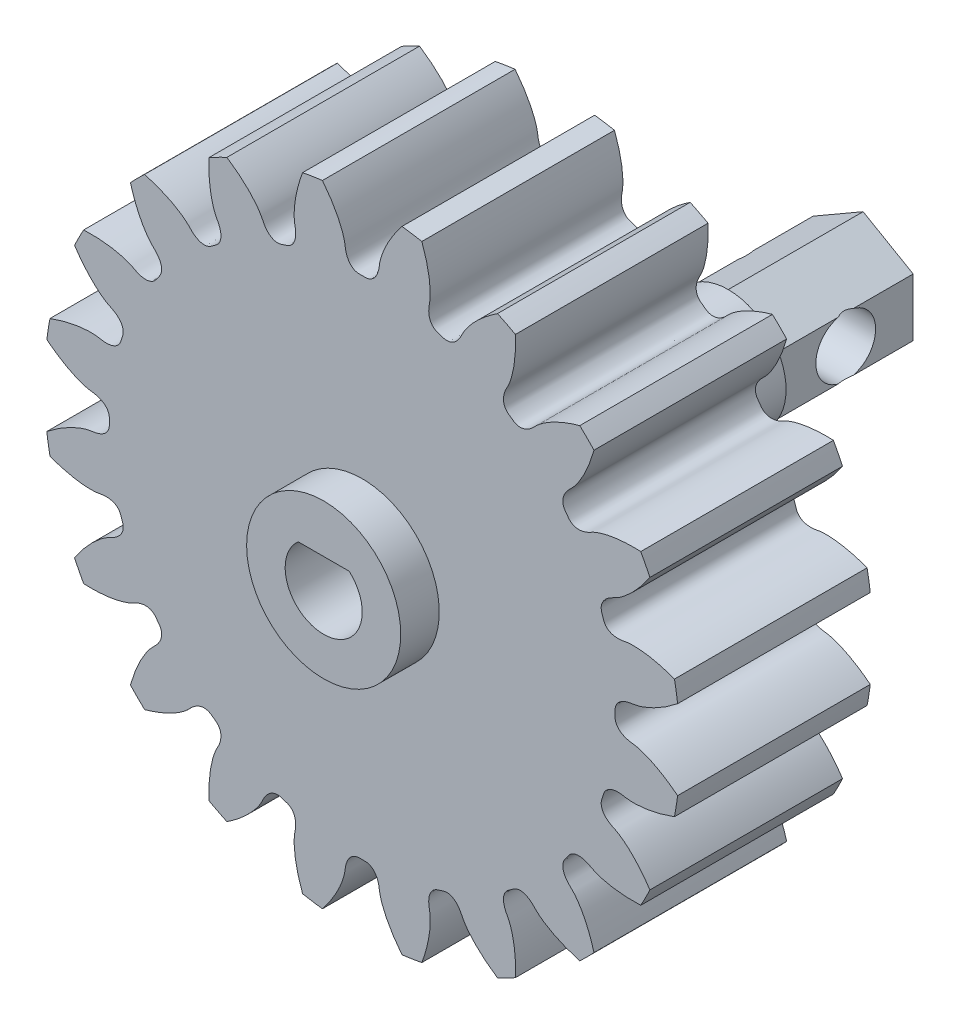
from build123d import *

# Parameters (mm, degrees)
SKETCHREVOLVESPURASSEMBLY01PINION_W       = 10
SKETCHREVOLVESPURASSEMBLY01PINION_H       = 16.499999752
TOOTHEXTRUDECUTSPURASSEMBLY01PINION_DEPTH = 5
PATTERNSPURASSEMBLY01PINION_COUNT         = 20
SKETCH2_R                                 = 3
BOSS_EXTRUDE1_DEPTH                       = 9
BOSS_EXTRUDE2_DEPTH                       = 7
CUT_EXTRUDE3_REACH                        = 34.692
SKETCH4_R                                 = 1.55
SKETCH5_R                                 = 4
BOSS_EXTRUDE3_DEPTH                       = 2
CUT_EXTRUDE4_DEPTH                        = 8


with BuildPart() as part:
    # SketchRevolveSpurAssembly01Pinion → SpurAssembly01Pinion (revolve)
    with BuildSketch(Plane(origin=(0, 0, 0), x_dir=(0, 0, -1), z_dir=(1, 0, 0)), mode=Mode.PRIVATE) as spurassembly01pinion_sk:
        with Locations((0, 8.249999876)):
            Rectangle(SKETCHREVOLVESPURASSEMBLY01PINION_W, SKETCHREVOLVESPURASSEMBLY01PINION_H)
    revolve(spurassembly01pinion_sk.sketch.rotate(Axis((0, 0, 0), (0, 0, -1)), 90), axis=Axis((0, 0, 0), (0, 0, -1)))

    # SketchToothSpurAssembly01Pinion → ToothExtrudeCutSpurAssembly01Pinion (cut, symmetric)
    with BuildSketch(Plane.XY):
        with BuildLine():
            ThreePointArc((16.438815928, 2.120364973), (16.574999751, 0), (16.438815928, -2.120364973))
            add(Edge.make_bspline(
                [(16.438815928, -2.120364973), (16.306213447, -2.012632117), (16.10792267, -1.860929635), (15.841705586, -1.676668952), (15.654853966, -1.55570694), (15.475899367, -1.447553762), (15.305444286, -1.351598726), (15.144060802, -1.267206194), (14.992289617, -1.193717223), (14.850639167, -1.130450865), (14.719584807, -1.0767054), (14.599567969, -1.031760257), (14.490995634, -0.99487577), (14.394239041, -0.965299916), (14.309634999, -0.942253529), (14.237479548, -0.924980687), (14.178044201, -0.912608864), (14.049223501, -0.890261122), (13.912281496, -0.878231728), (13.769652297, -0.842658369), (13.695599357, -0.820644128), (13.624377747, -0.794966749), (13.555692175, -0.765356143), (13.489258635, -0.731124882), (13.424830796, -0.691333031), (13.362331646, -0.644635632), (13.30209452, -0.589245233), (13.24524803, -0.523019137), (13.194309632, -0.443877425), (13.153279262, -0.350864326), (13.130262908, -0.253354669), (13.120821868, -0.134969136), (13.12767395, 0), (13.120821868, 0.134969136), (13.130262908, 0.253354669), (13.153279262, 0.350864326), (13.194309632, 0.443877425), (13.24524803, 0.523019137), (13.30209452, 0.589245233), (13.362331646, 0.644635632), (13.424830796, 0.691333031), (13.489258635, 0.731124882), (13.555692175, 0.765356143), (13.624377747, 0.794966749), (13.695599357, 0.820644128), (13.769652297, 0.842658369), (13.912281496, 0.878231728), (14.049223501, 0.890261122), (14.178044201, 0.912608864), (14.237479548, 0.924980687), (14.309634999, 0.942253529), (14.394239041, 0.965299916), (14.490995634, 0.99487577), (14.599567969, 1.031760257), (14.719584807, 1.0767054), (14.850639167, 1.130450865), (14.992289617, 1.193717223), (15.144060802, 1.267206194), (15.305444286, 1.351598726), (15.475899367, 1.447553762), (15.654853966, 1.55570694), (15.841705586, 1.676668952), (16.10792267, 1.860929635), (16.306213447, 2.012632117), (16.438815928, 2.120364973)],
                knots=[0, 0, 0, 0, 0.061422842, 0.089709677, 0.116380121, 0.141434175, 0.164871838, 0.186693111, 0.206897994, 0.225486485, 0.242458587, 0.257814298, 0.271553618, 0.283676548, 0.294183087, 0.303073236, 0.310346995, 0.316004363, 0.350076802, 0.359567688, 0.36880314, 0.37784437, 0.386769007, 0.395675631, 0.404688756, 0.413962948, 0.423682731, 0.434051196, 0.445255861, 0.457401439, 0.47041984, 0.481066796, 0.5, 0.518933204, 0.52958016, 0.542598561, 0.554744139, 0.565948804, 0.576317269, 0.586037052, 0.595311244, 0.604324369, 0.613230993, 0.62215563, 0.63119686, 0.640432312, 0.649923198, 0.683995637, 0.689653005, 0.696926764, 0.705816913, 0.716323452, 0.728446382, 0.742185702, 0.757541413, 0.774513515, 0.793102006, 0.813306889, 0.835128162, 0.858565825, 0.883619879, 0.910290323, 0.938577158, 1, 1, 1, 1], degree=3))
        make_face()
    toothextrudecutspurassembly01pinion = extrude(amount=TOOTHEXTRUDECUTSPURASSEMBLY01PINION_DEPTH, both=True, mode=Mode.SUBTRACT)

    # PatternSpurAssembly01Pinion: ToothExtrudeCutSpurAssembly01Pinion ×20 about axis
    patternspurassembly01pinion_axis = Axis((0, 0, 55), (0, 0, -1))
    for i in range(1, PATTERNSPURASSEMBLY01PINION_COUNT):
        add(toothextrudecutspurassembly01pinion.rotate(patternspurassembly01pinion_axis, i * 360 / PATTERNSPURASSEMBLY01PINION_COUNT), mode=Mode.SUBTRACT)

    # Sketch2 → Boss-Extrude1 (add)
    with BuildSketch(Plane(origin=(0, 0, -5), x_dir=(-1, 0, 0), z_dir=(0, 0, -1))):
        with Locations(Location((0, 0, 0), (0, 0, 180))):
            Circle(SKETCH2_R)
    extrude(amount=BOSS_EXTRUDE1_DEPTH)

    # Sketch3 → Boss-Extrude2 (add)
    with BuildSketch(Plane(origin=(0, 0, -14), x_dir=(-1, 0, 0), z_dir=(0, 0, -1))):
        Polygon((0, 3), (-2.598076211, 1.5), (-2.598076211, -1.5), (0, -3), (2.598076211, -1.5), (2.598076211, 1.5), align=None)
    extrude(amount=BOSS_EXTRUDE2_DEPTH)

    # Cut-Extrude3: up to this face of the body (flat: up to its plane)
    cut_extrude3_end = Plane(part.part.faces().sort_by_distance((-2.598076211, 0, -17.5))[0])
    # Sketch4 → Cut-Extrude3 (cut, up to the picked face)
    with BuildSketch(Plane(origin=(2.598076211, 0, 0), x_dir=(0, 0, -1), z_dir=(1, 0, 0)), mode=Mode.PRIVATE) as cut_extrude3_sk1:
        with Locations(Location((17.5, 0, 0), (0, 0, 104.592550602))):
            Circle(SKETCH4_R)
    cut_extrude3_tool1 = split(extrude(cut_extrude3_sk1.sketch, amount=-CUT_EXTRUDE3_REACH, mode=Mode.PRIVATE), bisect_by=cut_extrude3_end, keep=Keep.BOTH, mode=Mode.PRIVATE)
    add(cut_extrude3_tool1.solids().sort_by(Axis((2.598076, 0, -17.5), (-1, 0, 0)))[0], mode=Mode.SUBTRACT)

    # Sketch5 → Boss-Extrude3 (add)
    with BuildSketch(Plane.XY.offset(5)):
        with Locations(Location((0, 0, 0), (0, 0, 180))):
            Circle(SKETCH5_R)
    extrude(amount=BOSS_EXTRUDE3_DEPTH)

    # Sketch6 → Cut-Extrude4 (cut)
    with BuildSketch(Plane.XY.offset(7)):
        with BuildLine():
            Line((-1.322875656, 1.5), (1.322875656, 1.5))
            ThreePointArc((1.322875656, 1.5), (0, -2), (-1.322875656, 1.5))
        make_face()
    extrude(amount=-CUT_EXTRUDE4_DEPTH, mode=Mode.SUBTRACT)


solid = part.part
